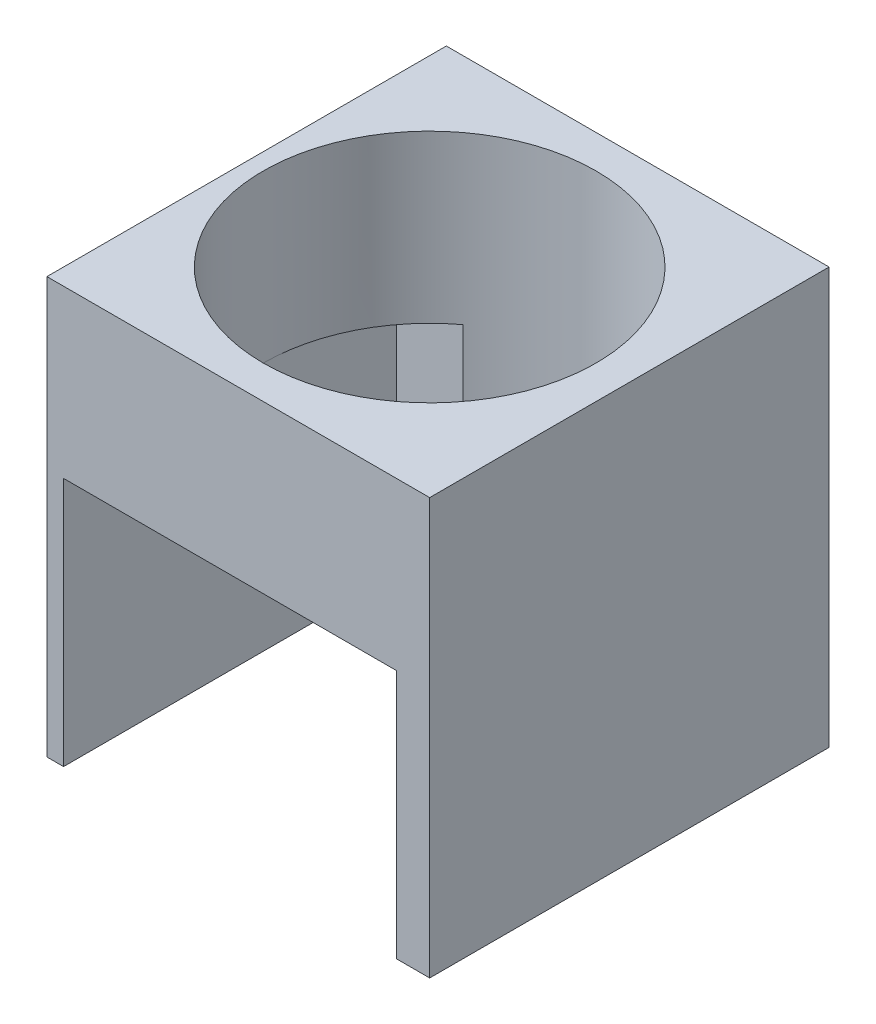
from build123d import *

# Parameters (mm, degrees)
SKETCH1_W                      = 670
SKETCH1_H                      = 120
BOSS_EXTRUDE1_DEPTH            = 530
SKETCH2_W                      = 100
SKETCH2_H                      = 200
SKETCH2_W_2                    = 650
SKETCH2_H_2                    = 250
CUT_EXTRUDE1_DEPTH             = 100
SKETCH3_R                      = 50
CUT_EXTRUDE2_DEPTH             = 260
F_12_0_12_DIAMETER_HOLE2_D     = 12
F_12_0_12_DIAMETER_HOLE2_DEPTH = 30
F_12_0_12_DIAMETER_HOLE2_TIP   = 3.605163714
SKETCH8_W                      = 650
SKETCH8_H                      = 50
BOSS_EXTRUDE2_DEPTH            = 5
SKETCH9_W                      = 10
SKETCH9_H                      = 250
CUT_EXTRUDE3_DEPTH             = 717
CUT_EXTRUDE4_DEPTH             = 5
SKETCH11_W                     = 10
SKETCH11_H                     = 100
BOSS_EXTRUDE3_DEPTH            = 78
BOSS_EXTRUDE3_2_DEPTH          = 78
BOSS_EXTRUDE3_3_DEPTH          = 78
SKETCH12_W                     = 20
SKETCH12_H                     = 30
CUT_EXTRUDE5_DEPTH             = 80
SKETCH15_W                     = 30
SKETCH15_H                     = 23.536156656
SKETCH15_H_2                   = 28.986603691
CUT_EXTRUDE7_DEPTH             = 35
SHELL1_T                       = -3
SKETCH16_W                     = 14
SKETCH16_H                     = 14
CUT_EXTRUDE8_DEPTH             = 35
SKETCH17_W                     = 5.729882812
SKETCH17_H                     = 17.428393554
SKETCH17_W_2                   = 13.369726562
SKETCH17_H_2                   = 3.342431641
BOSS_EXTRUDE4_DEPTH            = 5
SKETCH18_W                     = 670
SKETCH18_H                     = 280
CUT_EXTRUDE10_DEPTH            = 159
CUT_EXTRUDE12_DEPTH            = 59
CUT_EXTRUDE12_DEPTH_BACK       = 135
SKETCH19_W                     = 555
SKETCH19_H                     = 250
CUT_EXTRUDE13_DEPTH            = 863.670273187
CUT_EXTRUDE13_DEPTH_BACK       = 863.670273187
SKETCH20_W                     = 115
SKETCH20_H                     = 125


with BuildPart() as part:
    # Sketch1 → Boss-Extrude1 (new body)
    with BuildSketch(Plane(origin=(0, 0, 0), x_dir=(1, 0, 0), z_dir=(0, 1, 0))):
        with Locations((335, 60)):
            Rectangle(SKETCH1_W, SKETCH1_H)
    extrude(amount=BOSS_EXTRUDE1_DEPTH)

    # Sketch2 → Cut-Extrude1 (cut)
    with BuildSketch(Plane.XY):
        with Locations((60, 380)):
            Rectangle(SKETCH2_W, SKETCH2_H)
        with Locations((170, 380)):
            Rectangle(SKETCH2_W, SKETCH2_H)
        with Locations((280, 380)):
            Rectangle(SKETCH2_W, SKETCH2_H)
        with Locations((390, 380)):
            Rectangle(SKETCH2_W, SKETCH2_H)
        with Locations((500, 380)):
            Rectangle(SKETCH2_W, SKETCH2_H)
        with Locations((610, 380)):
            Rectangle(SKETCH2_W, SKETCH2_H)
        with Locations((335, 135)):
            Rectangle(SKETCH2_W_2, SKETCH2_H_2)
    extrude(amount=-CUT_EXTRUDE1_DEPTH, mode=Mode.SUBTRACT)

    # Sketch3 → Cut-Extrude2 (cut)
    with BuildSketch(Plane(origin=(0, 530, 0), x_dir=(1, 0, 0), z_dir=(0, 1, 0))):
        with Locations(Location((60, 60, 0), (0, 0, 270))):
            Circle(SKETCH3_R)
        with Locations(Location((170, 60, 0), (0, 0, 270))):
            Circle(SKETCH3_R)
        with Locations(Location((280, 60, 0), (0, 0, 270))):
            Circle(SKETCH3_R)
        with Locations(Location((390, 60, 0), (0, 0, 270))):
            Circle(SKETCH3_R)
        with Locations(Location((500, 60, 0), (0, 0, 270))):
            Circle(SKETCH3_R)
        with Locations(Location((610, 60, 0), (0, 0, 270))):
            Circle(SKETCH3_R)
    extrude(amount=-CUT_EXTRUDE2_DEPTH, mode=Mode.SUBTRACT)

    # Ø12.0 (12) Diameter Hole2
    with Locations(Plane(origin=(59.704642413, 270, -102.411697903), x_dir=(0, 0, 1), z_dir=(0, 1, 0))):
        with Locations((0, 0), (-0.195888006, 111.8520513), (0.014838595, 221.167624818), (-0.341843303, 331.364008353), (0.657723149, 441.008646429), (1.288998006, 549.811854685)):
            Hole(F_12_0_12_DIAMETER_HOLE2_D / 2, depth=F_12_0_12_DIAMETER_HOLE2_DEPTH)
            with Locations((0, 0, -(F_12_0_12_DIAMETER_HOLE2_DEPTH + F_12_0_12_DIAMETER_HOLE2_TIP / 2))):  # 118° drill point
                Cone(0, F_12_0_12_DIAMETER_HOLE2_D / 2, F_12_0_12_DIAMETER_HOLE2_TIP, mode=Mode.SUBTRACT)

    # Sketch8 → Boss-Extrude2 (add)
    with BuildSketch(Plane.XY):
        with Locations((335, 305)):
            Rectangle(SKETCH8_W, SKETCH8_H)
    extrude(amount=-BOSS_EXTRUDE2_DEPTH)

    # Sketch9 → Cut-Extrude3 (cut)
    with BuildSketch(Plane(origin=(670, 0, 0), x_dir=(0, 0, -1), z_dir=(1, 0, 0))):
        with Locations((15, 135)):
            Rectangle(SKETCH9_W, SKETCH9_H)
    extrude(amount=-CUT_EXTRUDE3_DEPTH, mode=Mode.SUBTRACT)

    # Sketch10 → Cut-Extrude4 (cut)
    with BuildSketch(Plane(origin=(0, 10, 0), x_dir=(1, 0, 0), z_dir=(0, 1, 0))):
        Polygon((365, 61.943560596), (350, 87.924322709), (320, 87.924322709), (305, 61.943560596), (320, 35.962798482), (350, 35.962798482), align=None)
    extrude(amount=-CUT_EXTRUDE4_DEPTH, mode=Mode.SUBTRACT)

    # Sketch12 → Cut-Extrude5 (cut)
    with BuildSketch(Plane.XY.offset(-100)):
        with Locations((85.198613037, 245)):
            Rectangle(SKETCH12_W, SKETCH12_H)
        with Locations((195.198613037, 245)):
            Rectangle(SKETCH12_W, SKETCH12_H)
        with Locations((305.198613037, 245)):
            Rectangle(SKETCH12_W, SKETCH12_H)
        with Locations((415.198613037, 245)):
            Rectangle(SKETCH12_W, SKETCH12_H)
        with Locations((525.198613037, 245)):
            Rectangle(SKETCH12_W, SKETCH12_H)
        with Locations((635.198613037, 245)):
            Rectangle(SKETCH12_W, SKETCH12_H)
    extrude(amount=-CUT_EXTRUDE5_DEPTH, mode=Mode.SUBTRACT)

    # Sketch17 → Boss-Extrude4 (add)
    # profile 1 of 9: a face of its own
    with BuildSketch(Plane.XY):
        with BuildLine():
            Line((527.508830928, 289.835452458), (527.508830928, 307.263846012))
            Line((527.508830928, 307.263846012), (534.861434459, 307.263846012))
            add(Edge.make_bspline(
                [(534.861434459, 307.263846012), (535.181337774, 307.258256848), (535.803061116, 307.24739446), (536.703508491, 307.139069344), (537.544992916, 306.975202489), (538.325061607, 306.737496792), (539.040841948, 306.426020155), (539.698044515, 306.051894954), (540.290333057, 305.605079277), (540.822348212, 305.090232636), (541.284521701, 304.502523111), (541.692171296, 303.852565801), (542.030284458, 303.129762281), (542.309377095, 302.341316546), (542.5243908, 301.484161689), (542.679660381, 300.560045938), (542.773357357, 299.567500804), (542.783368073, 298.883107022), (542.788518428, 298.530997273)],
                knots=[0, 0, 0, 0, 1.135059408, 2.20595691, 3.214417064, 4.174978569, 5.094187092, 5.980001006, 6.853065862, 7.720814779, 8.600404634, 9.50058483, 10.438414914, 11.426825708, 12.465239141, 13.571113463, 14.750376389, 16, 16, 16, 16], degree=3))
            add(Edge.make_bspline(
                [(542.788518428, 298.530997273), (542.781740751, 298.180151665), (542.768592871, 297.499553336), (542.676885992, 296.511518461), (542.516733301, 295.591080531), (542.296748778, 294.736450427), (542.003051046, 293.953120444), (541.654236167, 293.233205539), (541.233025793, 292.585291498), (540.753136904, 292.000029304), (540.204772188, 291.484681411), (539.587651059, 291.044279297), (538.910779309, 290.668464036), (538.169670382, 290.361903209), (537.364073889, 290.124869172), (536.495133477, 289.954199984), (535.562644449, 289.853487388), (534.920131033, 289.841584621), (534.58911581, 289.835452458)],
                knots=[0, 0, 0, 0, 1.228418252, 2.382983832, 3.470276728, 4.496757894, 5.468023682, 6.394867725, 7.292157164, 8.167372942, 9.039072913, 9.918728341, 10.815246345, 11.744296628, 12.720973084, 13.750736166, 14.841206188, 16, 16, 16, 16], degree=3))
            Line((534.58911581, 289.835452458), (527.508830928, 289.835452458))
        make_face()
        with BuildLine():
            Line((533.238713741, 291.745413395), (534.048208904, 291.745413395))
            add(Edge.make_bspline(
                [(534.048208904, 291.745413395), (534.172894012, 291.749291978), (534.413033311, 291.756761998), (534.758676231, 291.825976613), (535.075745017, 291.938271137), (535.365749176, 292.094802589), (535.623404602, 292.300450923), (535.848862806, 292.551404902), (536.04776914, 292.844737637), (536.217685755, 293.190205032), (536.364284647, 293.596533622), (536.481764702, 294.076367921), (536.592118304, 294.630928744), (536.673672739, 295.265507643), (536.740044562, 295.978448886), (536.788346679, 296.768428292), (536.812018936, 297.636801208), (536.817188964, 298.241258393), (536.819890499, 298.55711002)],
                knots=[0, 0, 0, 0, 0.728710832, 1.403472396, 2.052289494, 2.690292559, 3.321919393, 3.970736491, 4.656696891, 5.388631723, 6.217040872, 7.17856157, 8.275589967, 9.523440737, 10.918935818, 12.463926104, 14.152268318, 16, 16, 16, 16], degree=3))
            add(Edge.make_bspline(
                [(536.819890499, 298.55711002), (536.8171426, 298.871715251), (536.811863063, 299.476166083), (536.7886758, 300.343334385), (536.739579947, 301.133216935), (536.674703848, 301.843934916), (536.589660404, 302.476324031), (536.488366458, 303.031681737), (536.362441588, 303.507627045), (536.222158727, 303.914921549), (536.050140993, 304.256514038), (535.858357073, 304.554097881), (535.62547107, 304.79746827), (535.36991257, 305.004888479), (535.079348843, 305.160875844), (534.761320266, 305.273944358), (534.414185903, 305.34216807), (534.172870641, 305.349893944), (534.048208904, 305.353885075)],
                knots=[0, 0, 0, 0, 1.842836665, 3.540640921, 5.080358154, 6.47765669, 7.719902824, 8.816971715, 9.781579111, 10.601733135, 11.334613876, 12.017393917, 12.666641099, 13.29908421, 13.937911793, 14.587567384, 15.270347425, 16, 16, 16, 16], degree=3))
            Line((534.048208904, 305.353885075), (533.238713741, 305.353885075))
            Line((533.238713741, 305.353885075), (533.238713741, 291.745413395))
        make_face(mode=Mode.SUBTRACT)
    # profile 2 of 9: a face of its own
    with BuildSketch(Plane.XY):
        with Locations((547.563420772, 298.549649235)):
            Rectangle(SKETCH17_W, SKETCH17_H)
    # profile 3 of 9: a face of its own
    with BuildSketch(Plane.XY):
        Polygon((564.514324092, 307.263846012), (564.514324092, 305.115139958), (558.545696163, 305.115139958), (558.545696163, 299.862747379), (563.559343624, 299.862747379), (563.559343624, 297.714041325), (558.545696163, 297.714041325), (558.545696163, 289.835452458), (552.81581335, 289.835452458), (552.81581335, 307.263846012), align=None)
    # profile 4 of 9: a face of its own
    with BuildSketch(Plane.XY):
        Polygon((577.645305538, 307.263846012), (577.645305538, 305.115139958), (571.676677608, 305.115139958), (571.676677608, 299.862747379), (576.690325069, 299.862747379), (576.690325069, 297.714041325), (571.676677608, 297.714041325), (571.676677608, 289.835452458), (565.946794795, 289.835452458), (565.946794795, 307.263846012), align=None)
    # profile 5 of 9: a face of its own
    with BuildSketch(Plane.XY):
        with Locations((584.330168819, 287.448001286)):
            Rectangle(SKETCH17_W_2, SKETCH17_H_2)
    # profile 6 of 9: a face of its own
    with BuildSketch(Plane.XY):
        with BuildLine():
            Line((605.578484249, 307.263846012), (605.578484249, 295.602639195))
            add(Edge.make_bspline(
                [(605.578484249, 295.602639195), (605.574209777, 295.35989389), (605.565919345, 294.889083964), (605.480877158, 294.20653885), (605.349958188, 293.569747554), (605.15926554, 292.978838165), (604.911867049, 292.436847071), (604.616163877, 291.936663973), (604.260702644, 291.487723021), (603.847299908, 291.08966617), (603.386881991, 290.731670113), (602.867295001, 290.425440037), (602.293741958, 290.168488385), (601.66690529, 289.960990771), (600.988052682, 289.797299786), (600.254912883, 289.679078851), (599.467035781, 289.60781007), (598.923618241, 289.60048219), (598.643684673, 289.59670734)],
                knots=[0, 0, 0, 0, 1.108173197, 2.149326602, 3.136215123, 4.073726706, 4.978516626, 5.852185058, 6.72141202, 7.584905625, 8.467554395, 9.379216169, 10.332422268, 11.332766067, 12.390653242, 13.518530507, 14.721707419, 16, 16, 16, 16], degree=3))
            add(Edge.make_bspline(
                [(598.643684673, 289.59670734), (598.373688491, 289.600411437), (597.851346557, 289.607577482), (597.093280473, 289.679448684), (596.387523889, 289.797736542), (595.733050135, 289.960122315), (595.130189942, 290.169220301), (594.579048171, 290.42623041), (594.078350789, 290.732835498), (593.633858028, 291.090104794), (593.234289459, 291.486851767), (592.899913678, 291.940746827), (592.609043638, 292.435866034), (592.375223767, 292.980322997), (592.191754821, 293.570441519), (592.063541006, 294.20666921), (591.983676196, 294.889343196), (591.974661767, 295.359932437), (591.970012569, 295.602639195)],
                knots=[0, 0, 0, 0, 1.258901956, 2.435505865, 3.547148904, 4.59359074, 5.576649289, 6.5183682, 7.424469602, 8.307507093, 9.172751023, 10.042627298, 10.928839176, 11.845659241, 12.799442865, 13.80597989, 14.868432463, 16, 16, 16, 16], degree=3))
            Line((591.970012569, 295.602639195), (591.970012569, 307.263846012))
            Line((591.970012569, 307.263846012), (597.699895381, 307.263846012))
            Line((597.699895381, 307.263846012), (597.699895381, 295.457153889))
            add(Edge.make_bspline(
                [(597.699895381, 295.457153889), (597.700816195, 295.287996189), (597.702584578, 294.963135903), (597.729908723, 294.499051493), (597.768241004, 294.079064133), (597.828226169, 293.705517832), (597.90066041, 293.377063412), (597.989882091, 293.09281535), (598.094998068, 292.852496478), (598.225239063, 292.654232043), (598.380826623, 292.495135011), (598.55368342, 292.353231761), (598.757556996, 292.238543846), (598.987648905, 292.146224908), (599.243380948, 292.070549638), (599.526120553, 292.020376099), (599.83553351, 291.990763905), (600.049971942, 291.986424568), (600.161954402, 291.984158512)],
                knots=[0, 0, 0, 0, 1.622370975, 3.115695595, 4.458049099, 5.666011203, 6.742434742, 7.681714947, 8.519814998, 9.250928664, 9.942747364, 10.646898194, 11.389596108, 12.175933929, 13.021386247, 13.943159715, 14.925891993, 16, 16, 16, 16], degree=3))
            add(Edge.make_bspline(
                [(600.161954402, 291.984158512), (600.283927219, 291.987190593), (600.521124756, 291.993087005), (600.86597014, 292.03390861), (601.187714881, 292.103380086), (601.484890424, 292.205377303), (601.758665297, 292.332852529), (602.012761516, 292.484567923), (602.236391413, 292.674631152), (602.439076761, 292.888441291), (602.620738276, 293.128529789), (602.771757722, 293.399928575), (602.905501548, 293.697121508), (603.005823683, 294.025060118), (603.089837826, 294.379999499), (603.146989706, 294.763086929), (603.186210275, 295.174074524), (603.189394751, 295.457053988), (603.191033077, 295.602639195)],
                knots=[0, 0, 0, 0, 1.083870311, 2.107775948, 3.08105344, 4.003637981, 4.893545291, 5.761570557, 6.624657808, 7.49233129, 8.376387281, 9.291996285, 10.246843261, 11.267344133, 12.334180325, 13.486053461, 14.706643157, 16, 16, 16, 16], degree=3))
            Line((603.191033077, 295.602639195), (603.191033077, 307.263846012))
            Line((603.191033077, 307.263846012), (605.578484249, 307.263846012))
        make_face()
    # profile 7 of 9: a face of its own
    with BuildSketch(Plane.XY):
        with BuildLine():
            Line((619.731593227, 302.015183827), (616.739818477, 301.526502415))
            add(Edge.make_bspline(
                [(616.739818477, 301.526502415), (616.748849224, 301.670726223), (616.765660669, 301.939210177), (616.78429066, 302.312269209), (616.796668381, 302.625642376), (616.798628236, 302.814722915), (616.799504756, 302.899286839)],
                knots=[0, 0, 0, 0, 1.261802504, 2.348944521, 3.261585937, 4, 4, 4, 4], degree=3))
            add(Edge.make_bspline(
                [(616.799504756, 302.899286839), (616.798306068, 303.007660677), (616.795968139, 303.219033721), (616.750451916, 303.523894877), (616.694806916, 303.811547356), (616.604352699, 304.076787391), (616.488181329, 304.320314265), (616.348943917, 304.543955606), (616.184187178, 304.745078709), (615.995833421, 304.928129987), (615.778009957, 305.083200131), (615.536269472, 305.218702836), (615.269765326, 305.333844758), (614.978065514, 305.431346685), (614.660683072, 305.504624438), (614.319025281, 305.556776695), (613.952471696, 305.585673441), (613.699597795, 305.590260771), (613.568984889, 305.592630192)],
                knots=[0, 0, 0, 0, 1.079280541, 2.105035848, 3.067950317, 3.99715044, 4.889989748, 5.753421302, 6.617030865, 7.476358039, 8.364190572, 9.274590025, 10.235106994, 11.254473582, 12.337095886, 13.478601727, 14.697662529, 16, 16, 16, 16], degree=3))
            add(Edge.make_bspline(
                [(613.568984889, 305.592630192), (613.391954632, 305.58912286), (613.059112606, 305.582528579), (612.595688488, 305.495339748), (612.198743126, 305.361419257), (611.87165349, 305.163811893), (611.613188167, 304.909795747), (611.433841092, 304.593316589), (611.323009072, 304.224665915), (611.313400221, 303.959558324), (611.308367061, 303.820693775)],
                knots=[0, 0, 0, 0, 1.294917039, 2.43462794, 3.440028966, 4.347597256, 5.210608309, 6.06356377, 6.985685997, 8, 8, 8, 8], degree=3))
            add(Edge.make_bspline(
                [(611.308367061, 303.820693775), (611.317562032, 303.705133219), (611.336106628, 303.472068433), (611.47315858, 303.132808312), (611.695999602, 302.811560885), (612.009295906, 302.510664216), (612.404107796, 302.221967273), (612.884407504, 301.948533431), (613.450813789, 301.688189695), (613.862519081, 301.536023727), (614.080048656, 301.455624958)],
                knots=[0, 0, 0, 0, 0.716839541, 1.445735977, 2.240793036, 3.131329288, 4.131129903, 5.273471266, 6.559404876, 8, 8, 8, 8], degree=3))
            add(Edge.make_bspline(
                [(614.080048656, 301.455624958), (614.335934702, 301.364918412), (614.834564244, 301.188164095), (615.547657928, 300.88707802), (616.213068388, 300.5749594), (616.829579094, 300.246613346), (617.397833174, 299.90520698), (617.914851624, 299.544556457), (618.386199073, 299.173962102), (618.807001026, 298.783874588), (619.177995113, 298.378100064), (619.4958685, 297.952745357), (619.771807525, 297.51723103), (619.991113975, 297.061458502), (620.169645242, 296.594624218), (620.292698657, 296.11024444), (620.364288243, 295.609761088), (620.37516617, 295.270864226), (620.380681514, 295.099036213)],
                knots=[0, 0, 0, 0, 1.359488612, 2.649152603, 3.874964776, 5.039588756, 6.146130126, 7.193090393, 8.194917302, 9.146793662, 10.063845301, 10.944476293, 11.803344532, 12.641736646, 13.473440096, 14.302714936, 15.139439897, 16, 16, 16, 16], degree=3))
            add(Edge.make_bspline(
                [(620.380681514, 295.099036213), (620.374476075, 294.902306495), (620.362285176, 294.515820995), (620.280160209, 293.948630617), (620.138011896, 293.409496554), (619.938489338, 292.895972278), (619.681049879, 292.411946655), (619.366518754, 291.954381076), (618.996510229, 291.525099427), (618.5710008, 291.128381035), (618.102222518, 290.765302239), (617.587803957, 290.450854345), (617.034458515, 290.187092261), (616.444107988, 289.968993032), (615.81453624, 289.801373099), (615.145337453, 289.685291013), (614.438790193, 289.606619894), (613.954683001, 289.600062276), (613.70700941, 289.59670734)],
                knots=[0, 0, 0, 0, 0.972121714, 1.909782367, 2.824924061, 3.721832975, 4.62620438, 5.527836938, 6.46026819, 7.421000932, 8.398101015, 9.385579713, 10.394244048, 11.422703992, 12.491421888, 13.608778581, 14.776629625, 16, 16, 16, 16], degree=3))
            add(Edge.make_bspline(
                [(613.70700941, 289.59670734), (613.445745367, 289.599650312), (612.939893069, 289.605348413), (612.207608113, 289.66709241), (611.525297432, 289.760984454), (610.893395078, 289.899706116), (610.309273131, 290.072394336), (609.776099392, 290.288320955), (609.295310255, 290.547303481), (608.863217672, 290.843007892), (608.478306623, 291.175775461), (608.148120946, 291.551766865), (607.86942369, 291.967163224), (607.639947144, 292.421521488), (607.466477665, 292.917583541), (607.339164663, 293.449829748), (607.264537999, 294.021332449), (607.254747521, 294.414908557), (607.249700069, 294.617815586)],
                knots=[0, 0, 0, 0, 1.342201143, 2.598733168, 3.773451092, 4.878874364, 5.91991243, 6.900006476, 7.829142054, 8.72062616, 9.585588575, 10.436728592, 11.283829734, 12.149664931, 13.044964919, 13.977937424, 14.957531465, 16, 16, 16, 16], degree=3))
            add(Edge.make_bspline(
                [(607.249700069, 294.617815586), (607.250803815, 294.692425759), (607.253213998, 294.855347393), (607.260452266, 295.122772538), (607.275636683, 295.433682216), (607.29037174, 295.656130545), (607.298195171, 295.774237248)],
                knots=[0, 0, 0, 0, 0.773500207, 1.689044709, 2.77302154, 4, 4, 4, 4], degree=3))
            Line((607.298195171, 295.774237248), (610.36457777, 296.337526509))
            add(Edge.make_bspline(
                [(610.36457777, 296.337526509), (610.326952988, 296.136337493), (610.255606535, 295.754830366), (610.178678473, 295.21219969), (610.124206629, 294.733311493), (610.11767002, 294.435147371), (610.114641475, 294.297001835)],
                knots=[0, 0, 0, 0, 1.192988372, 2.262218769, 3.194850416, 4, 4, 4, 4], degree=3))
            add(Edge.make_bspline(
                [(610.114641475, 294.297001835), (610.116191817, 294.183708768), (610.119182568, 293.965156219), (610.159053378, 293.648552813), (610.215988606, 293.352999663), (610.302906772, 293.079707227), (610.411206928, 292.826307836), (610.544682453, 292.59538211), (610.704385489, 292.386485019), (610.887496571, 292.200099922), (611.094689168, 292.033628705), (611.327456494, 291.892756696), (611.58347653, 291.771733922), (611.864681562, 291.677479524), (612.167961721, 291.596080628), (612.497219749, 291.548235723), (612.849461228, 291.512043782), (613.092629543, 291.508500084), (613.218327999, 291.506668278)],
                knots=[0, 0, 0, 0, 1.135776692, 2.191015738, 3.19649269, 4.151244236, 5.061952528, 5.956281389, 6.819534407, 7.692823504, 8.571441916, 9.478554956, 10.416037156, 11.406231466, 12.450054172, 13.561596327, 14.739541482, 16, 16, 16, 16], degree=3))
            add(Edge.make_bspline(
                [(613.218327999, 291.506668278), (613.423996012, 291.510791273), (613.810619321, 291.518541853), (614.349272542, 291.616708407), (614.810575885, 291.768742445), (615.189785268, 291.991387532), (615.490778961, 292.278756613), (615.698005174, 292.637320004), (615.824813318, 293.05638326), (615.837728413, 293.355975238), (615.844524288, 293.513619419)],
                knots=[0, 0, 0, 0, 1.308765556, 2.460272085, 3.475015317, 4.388076298, 5.239673503, 6.095681635, 6.997954785, 8, 8, 8, 8], degree=3))
            add(Edge.make_bspline(
                [(615.844524288, 293.513619419), (615.833808824, 293.638242951), (615.811807312, 293.894126055), (615.644884004, 294.264515838), (615.382382362, 294.620631473), (615.016807277, 294.962984909), (614.551376589, 295.293471235), (613.986957743, 295.616730224), (613.322148235, 295.933112033), (612.83677959, 296.119639164), (612.580430889, 296.21815395)],
                knots=[0, 0, 0, 0, 0.667930748, 1.371427933, 2.146459016, 3.034714139, 4.04893387, 5.207327294, 6.525042705, 8, 8, 8, 8], degree=3))
            add(Edge.make_bspline(
                [(612.580430889, 296.21815395), (612.374354345, 296.29679374), (611.970646869, 296.450850434), (611.394079385, 296.713586304), (610.853066711, 296.987016804), (610.357486361, 297.288235735), (609.896382561, 297.599610528), (609.477036946, 297.932256792), (609.09841673, 298.284556341), (608.758710772, 298.653375077), (608.457302107, 299.038989264), (608.199448649, 299.444659231), (607.977533299, 299.866789834), (607.798609588, 300.308107488), (607.65975715, 300.767821241), (607.559616231, 301.244439392), (607.497905054, 301.739995674), (607.491630423, 302.075933546), (607.488445186, 302.246468159)],
                knots=[0, 0, 0, 0, 1.249558333, 2.447906163, 3.58867143, 4.682264114, 5.731748367, 6.739728761, 7.711906036, 8.659384707, 9.578321416, 10.481344598, 11.379544271, 12.277135726, 13.175418307, 14.097160112, 15.034047388, 16, 16, 16, 16], degree=3))
            add(Edge.make_bspline(
                [(607.488445186, 302.246468159), (607.49282555, 302.439538736), (607.501402184, 302.817565692), (607.587451154, 303.36980586), (607.719291893, 303.894921371), (607.910558542, 304.389343064), (608.156192894, 304.852853762), (608.453187669, 305.288766511), (608.804241719, 305.697593471), (609.213503754, 306.066686531), (609.657214714, 306.407618241), (610.14376173, 306.697651931), (610.658716537, 306.950861947), (611.210636666, 307.148827868), (611.791820619, 307.313252612), (612.408080529, 307.421140415), (613.056315391, 307.490701612), (613.499160755, 307.498567824), (613.725661373, 307.502591129)],
                knots=[0, 0, 0, 0, 1.01033566, 1.978209831, 2.919499157, 3.840961976, 4.746855014, 5.660740114, 6.597989116, 7.56120833, 8.541877795, 9.523498025, 10.522416858, 11.542172371, 12.589598349, 13.681636521, 14.814234488, 16, 16, 16, 16], degree=3))
            add(Edge.make_bspline(
                [(613.725661373, 307.502591129), (613.968269855, 307.498219033), (614.438190994, 307.489750488), (615.120391152, 307.426787419), (615.755073228, 307.319142339), (616.345153155, 307.171557286), (616.887304575, 306.977590666), (617.384933999, 306.742393454), (617.834452216, 306.46201507), (618.236961315, 306.139451502), (618.593086714, 305.773322851), (618.897467704, 305.361641069), (619.158701245, 304.909408454), (619.366684143, 304.412232174), (619.529870326, 303.873247147), (619.649133834, 303.29158184), (619.720420497, 302.667301443), (619.72779778, 302.236712324), (619.731593227, 302.015183827)],
                knots=[0, 0, 0, 0, 1.248314423, 2.417925914, 3.521398822, 4.558068205, 5.543720209, 6.479599284, 7.385061127, 8.263440163, 9.127722873, 10.00561236, 10.891325273, 11.808802823, 12.772251995, 13.784947978, 14.860405143, 16, 16, 16, 16], degree=3))
        make_face()
    # profile 8 of 9: a face of its own
    with BuildSketch(Plane.XY):
        Polygon((633.989153194, 307.263846012), (633.989153194, 305.115139958), (628.020525264, 305.115139958), (628.020525264, 300.340237614), (633.034172725, 300.340237614), (633.034172725, 298.191531559), (628.020525264, 298.191531559), (628.020525264, 291.984158512), (634.944133663, 291.984158512), (634.944133663, 289.835452458), (622.290642452, 289.835452458), (622.290642452, 307.263846012), align=None)
    # profile 9 of 9: a face of its own
    with BuildSketch(Plane.XY):
        with BuildLine():
            Line((636.376604366, 289.835452458), (636.376604366, 307.263846012))
            Line((636.376604366, 307.263846012), (643.990335369, 307.263846012))
            add(Edge.make_bspline(
                [(643.990335369, 307.263846012), (644.237946498, 307.261150834), (644.721600887, 307.25588639), (645.426490561, 307.189203683), (646.094808274, 307.090496236), (646.724915796, 306.949857504), (647.317873659, 306.767252686), (647.871119087, 306.542146), (648.390701058, 306.282329135), (648.864494846, 305.976472528), (649.295093616, 305.642889252), (649.669668547, 305.279483604), (649.990389523, 304.894749072), (650.250664962, 304.483256345), (650.454275633, 304.048690948), (650.59581384, 303.587791605), (650.684089268, 303.104102537), (650.695510601, 302.772834174), (650.701311397, 302.604585835)],
                knots=[0, 0, 0, 0, 1.303269877, 2.545653735, 3.724355284, 4.8584284, 5.941462088, 6.987020715, 8.000098032, 8.995332524, 9.951400474, 10.863507538, 11.737823931, 12.582415999, 13.420128714, 14.25671499, 15.114600608, 16, 16, 16, 16], degree=3))
            add(Edge.make_bspline(
                [(650.701311397, 302.604585835), (650.698282873, 302.472674957), (650.692382063, 302.215658276), (650.651041486, 301.838684287), (650.580643818, 301.480313933), (650.481036683, 301.139915259), (650.347814833, 300.820175594), (650.191279492, 300.517863507), (650.009772227, 300.230553342), (649.788675198, 299.970497982), (649.548268341, 299.722842359), (649.274558803, 299.497116911), (648.974487035, 299.288655528), (648.642526299, 299.104010513), (648.287619671, 298.928055749), (647.899038177, 298.784921972), (647.486819978, 298.644749395), (647.19793098, 298.577036306), (647.049257183, 298.54218845)],
                knots=[0, 0, 0, 0, 1.057156483, 2.059775939, 3.035078039, 3.981068617, 4.897189472, 5.80650904, 6.70770952, 7.613691521, 8.536886357, 9.470937334, 10.45233069, 11.461024139, 12.51295332, 13.623444893, 14.776929983, 16, 16, 16, 16], degree=3))
            add(Edge.make_bspline(
                [(647.049257183, 298.54218845), (647.19164695, 298.499279419), (647.467865022, 298.416041346), (647.856360945, 298.265600017), (648.211652989, 298.111536308), (648.524185739, 297.936781388), (648.807636894, 297.762122504), (649.047122259, 297.564301324), (649.255235567, 297.361673563), (649.425188343, 297.135464734), (649.570253643, 296.882344437), (649.694827156, 296.586596707), (649.815179167, 296.247423665), (649.917667348, 295.859098311), (650.004750555, 295.423699276), (650.088222437, 294.944027189), (650.153853601, 294.416024546), (650.187587341, 294.048412906), (650.2051692, 293.856815525)],
                knots=[0, 0, 0, 0, 1.149282524, 2.229462177, 3.219229774, 4.139917433, 4.995948464, 5.788695735, 6.536448429, 7.236319808, 7.968460079, 8.78645307, 9.713791991, 10.749194692, 11.887975363, 13.146018663, 14.512518948, 16, 16, 16, 16], degree=3))
            add(Edge.make_bspline(
                [(650.2051692, 293.856815525), (650.225980287, 293.627849833), (650.265975604, 293.187817268), (650.348933081, 292.554613589), (650.44386163, 291.974357025), (650.555874504, 291.44528724), (650.681301216, 290.967898855), (650.821280597, 290.540469593), (650.979920039, 290.165788217), (651.10484481, 289.941461656), (651.163880062, 289.835452458)],
                knots=[0, 0, 0, 0, 1.324580516, 2.545615266, 3.678710841, 4.711533017, 5.660403917, 6.521349952, 7.301239649, 8, 8, 8, 8], degree=3))
            Line((651.163880062, 289.835452458), (645.213904094, 289.835452458))
            add(Edge.make_bspline(
                [(645.213904094, 289.835452458), (645.12229736, 290.069847279), (644.935171241, 290.548648246), (644.7595281, 291.319414791), (644.64846922, 292.142514735), (644.635117598, 292.70994511), (644.628232479, 293.002555653)],
                knots=[0, 0, 0, 0, 0.930410518, 1.900560147, 2.917368081, 4, 4, 4, 4], degree=3))
            Line((644.628232479, 293.002555653), (644.605850124, 294.002300831))
            Line((644.605850124, 294.002300831), (644.579737377, 295.266903874))
            add(Edge.make_bspline(
                [(644.579737377, 295.266903874), (644.573694669, 295.477395004), (644.562357007, 295.872330118), (644.469348432, 296.426164013), (644.30178735, 296.894645884), (644.073222546, 297.287223005), (643.766741442, 297.590613479), (643.39104803, 297.804152917), (642.950456912, 297.93396284), (642.634664848, 297.946292392), (642.468335247, 297.952786442)],
                knots=[0, 0, 0, 0, 1.295300309, 2.430314163, 3.439929415, 4.342995669, 5.203512789, 6.060756153, 6.978588463, 8, 8, 8, 8], degree=3))
            Line((642.468335247, 297.952786442), (642.106487178, 297.952786442))
            Line((642.106487178, 297.952786442), (642.106487178, 289.835452458))
            Line((642.106487178, 289.835452458), (636.376604366, 289.835452458))
        make_face()
        with BuildLine():
            Line((642.106487178, 299.862747379), (642.617550945, 299.862747379))
            add(Edge.make_bspline(
                [(642.617550945, 299.862747379), (642.722054451, 299.865172716), (642.925280724, 299.869889229), (643.220054897, 299.898289891), (643.494111408, 299.951809873), (643.749840966, 300.021017819), (643.984372137, 300.114851792), (644.200147241, 300.225818296), (644.391160406, 300.362685327), (644.565327067, 300.516342321), (644.718148635, 300.691986294), (644.850351299, 300.889034217), (644.961199162, 301.106225057), (645.056078491, 301.342818683), (645.125883912, 301.600830857), (645.173262731, 301.879472914), (645.203404658, 302.177423605), (645.207875435, 302.383174491), (645.210173702, 302.488943669)],
                knots=[0, 0, 0, 0, 1.184986479, 2.304423995, 3.352332712, 4.347714965, 5.303263624, 6.211353909, 7.091434645, 7.960150225, 8.839440182, 9.723126897, 10.64371617, 11.599264829, 12.608232147, 13.667459739, 14.800924404, 16, 16, 16, 16], degree=3))
            add(Edge.make_bspline(
                [(645.210173702, 302.488943669), (645.207875435, 302.594712847), (645.203404658, 302.800463732), (645.173262731, 303.098414423), (645.125883912, 303.37705648), (645.056078491, 303.635068654), (644.961199162, 303.87166228), (644.850351299, 304.08885312), (644.718148635, 304.285901043), (644.565327067, 304.461545017), (644.391160406, 304.61520201), (644.200147241, 304.752069041), (643.984372137, 304.863035546), (643.749840966, 304.956869518), (643.494111408, 305.026077464), (643.220054897, 305.079597446), (642.925280724, 305.107998108), (642.722054451, 305.112714621), (642.617550945, 305.115139958)],
                knots=[0, 0, 0, 0, 1.199075596, 2.332540261, 3.391767853, 4.400735171, 5.35628383, 6.276873103, 7.160559818, 8.039849775, 8.908565355, 9.788646091, 10.696736376, 11.652285035, 12.647667288, 13.695576005, 14.815013521, 16, 16, 16, 16], degree=3))
            Line((642.617550945, 305.115139958), (642.106487178, 305.115139958))
            Line((642.106487178, 305.115139958), (642.106487178, 299.862747379))
        make_face(mode=Mode.SUBTRACT)
    extrude(amount=BOSS_EXTRUDE4_DEPTH)


with BuildPart() as body_2:
    # Sketch11 → Boss-Extrude3 (new body)
    with BuildSketch(Plane.XY.offset(-100)):
        with Locations((255, 60)):
            Rectangle(SKETCH11_W, SKETCH11_H)
    extrude(amount=BOSS_EXTRUDE3_DEPTH)


with BuildPart() as body_3:
    # Sketch11 → Boss-Extrude3 2 (new body)
    with BuildSketch(Plane.XY.offset(-100)):
        with Locations((415, 60)):
            Rectangle(SKETCH11_W, SKETCH11_H)
    extrude(amount=BOSS_EXTRUDE3_2_DEPTH)


with BuildPart() as body_4:
    # Sketch11 → Boss-Extrude3 3 (new body)
    with BuildSketch(Plane.XY.offset(-100)):
        Polygon((25, 198.45686471), (325, 145.558770497), (325, 122.01775856), (345, 122.01775856), (345, 145.558770497), (645, 198.45686471), align=None)
    extrude(amount=BOSS_EXTRUDE3_3_DEPTH)

    # Sketch15 → Cut-Extrude7 (cut)
    with BuildSketch(Plane(origin=(345, 0, 0), x_dir=(0, 0, -1), z_dir=(1, 0, 0))):
        with Locations((35, 133.231921672)):
            Rectangle(SKETCH15_W, SKETCH15_H)
        with Locations((85, 130.506698154)):
            Rectangle(SKETCH15_W, SKETCH15_H_2)
    extrude(amount=-CUT_EXTRUDE7_DEPTH, mode=Mode.SUBTRACT)

    # Shell1
    shell1_openings = [body_4.faces().sort_by_distance(p)[0] for p in [
        (335, 198.45686471, -61),
    ]]
    offset(amount=SHELL1_T, openings=shell1_openings, kind=Kind.INTERSECTION)

    # Sketch16 → Cut-Extrude8 (cut)
    with BuildSketch(Plane.XZ.offset(-122.01775856)):
        with Locations((335, -60)):
            Rectangle(SKETCH16_W, SKETCH16_H)
    extrude(amount=-CUT_EXTRUDE8_DEPTH, mode=Mode.SUBTRACT)


with BuildPart() as cut_extrude10_tool:
    # Sketch18 → Cut-Extrude10 (new body)
    with BuildSketch(Plane.XY):
        with Locations((335, 140)):
            Rectangle(SKETCH18_W, SKETCH18_H)
    extrude(amount=-CUT_EXTRUDE10_DEPTH)


with BuildPart() as part_1:
    add(part.part)

    # Cut-Extrude10: cut by cut_extrude10_tool
    add(cut_extrude10_tool.part, mode=Mode.SUBTRACT)

    # Sketch19 → Cut-Extrude12 (cut, two sides: drawn at the far end of the back side and taken through both)
    with BuildSketch(Plane.XY.offset(-CUT_EXTRUDE12_DEPTH_BACK)):
        with Locations((277.5, 405)):
            Rectangle(SKETCH19_W, SKETCH19_H)
    extrude(amount=CUT_EXTRUDE12_DEPTH + CUT_EXTRUDE12_DEPTH_BACK, mode=Mode.SUBTRACT)

    # Sketch20 → Cut-Extrude13 (cut, two sides: drawn at the far end of the back side and taken through both)
    with BuildSketch(Plane.XY.offset(-CUT_EXTRUDE13_DEPTH_BACK)):
        with Locations((612.5, 342.5)):
            Rectangle(SKETCH20_W, SKETCH20_H)
    extrude(amount=CUT_EXTRUDE13_DEPTH + CUT_EXTRUDE13_DEPTH_BACK, mode=Mode.SUBTRACT)


with BuildPart() as body_2_1:
    add(body_2.part)

    # Cut-Extrude10: cut by cut_extrude10_tool
    add(cut_extrude10_tool.part, mode=Mode.SUBTRACT)


with BuildPart() as body_3_1:
    add(body_3.part)

    # Cut-Extrude10: cut by cut_extrude10_tool
    add(cut_extrude10_tool.part, mode=Mode.SUBTRACT)


with BuildPart() as body_4_1:
    add(body_4.part)

    # Cut-Extrude10: cut by cut_extrude10_tool
    add(cut_extrude10_tool.part, mode=Mode.SUBTRACT)


solid = part_1.part
